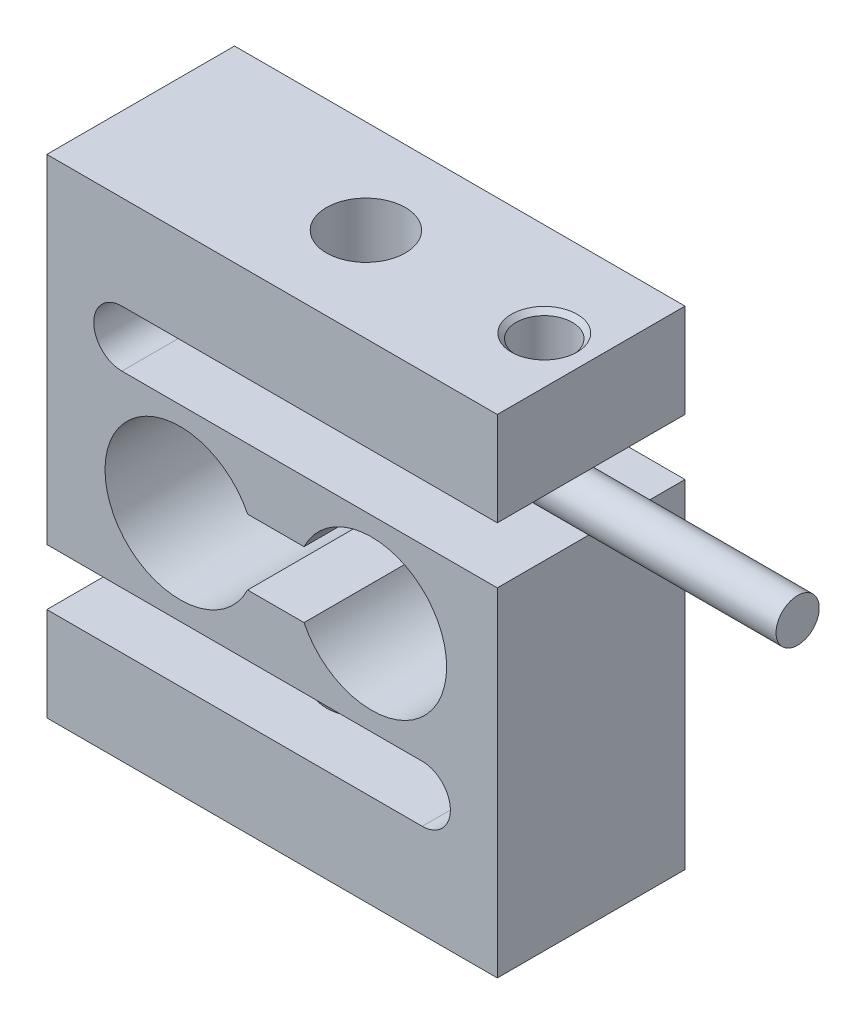
from build123d import *

# Parameters (mm, degrees)
SKIZZE1_W                            = 24
SKIZZE1_H                            = 26
AUFSATZ_LINEAR_AUSTRAGEN1_DEPTH      = 10
SCHNITT_LINEAR_AUSTRAGEN1_DEPTH      = 21.322401433
SCHNITT_LINEAR_AUSTRAGEN2_DEPTH      = 21.322401433
SCHNITT_LINEAR_AUSTRAGEN3_DEPTH      = 21.322401433
SKIZZE5_W                            = 4
SKIZZE5_H                            = 10
SKIZZE6_W                            = 4
SKIZZE6_H                            = 10
F_2_3_2_3_DURCHMESSER_BOHRUNG1_D     = 2.3
F_2_3_2_3_DURCHMESSER_BOHRUNG1_DEPTH = 24
SKIZZE9_W                            = 2.1
SKIZZE9_H                            = 5
F_3_0_3_DURCHMESSER_BOHRUNG1_D       = 3
F_3_0_3_DURCHMESSER_BOHRUNG1_DEPTH   = 5
SKIZZE13_W                           = 2.1
SKIZZE13_H                           = 5
F_3_0_3_DURCHMESSER_BOHRUNG2_D       = 3
F_3_0_3_DURCHMESSER_BOHRUNG2_DEPTH   = 5
FASE1_SIZE                           = 0.25
SENSORKABEL_START                    = -35
SKIZZE24_R                           = 1.15
SENSORKABEL_DEPTH                    = 35


with BuildPart() as part:
    # Skizze1 → Aufsatz-Linear austragen1 (new body)
    with BuildSketch(Plane.XY.offset(5)):
        Rectangle(SKIZZE1_W, SKIZZE1_H)
    extrude(amount=-AUFSATZ_LINEAR_AUSTRAGEN1_DEPTH)

    # Skizze2 → Schnitt-Linear austragen1 (cut, through all)
    with BuildSketch(Plane(origin=(0, 0, -5), x_dir=(-1, 0, 0), z_dir=(0, 0, -1))):
        with BuildLine():
            Line((12, -8), (12, -5))
            Line((12, -5), (-8, -5))
            ThreePointArc((-8, -5), (-9.5, -6.5), (-8, -8))
            Line((-8, -8), (12, -8))
        make_face()
    extrude(amount=-SCHNITT_LINEAR_AUSTRAGEN1_DEPTH, mode=Mode.SUBTRACT)

    # Skizze3 → Schnitt-Linear austragen2 (cut, through all)
    with BuildSketch(Plane(origin=(0, 0, -5), x_dir=(-1, 0, 0), z_dir=(0, 0, -1))):
        with BuildLine():
            Line((-12, 8), (-12, 5))
            Line((-12, 5), (8, 5))
            ThreePointArc((8, 5), (9.5, 6.5), (8, 8))
            Line((8, 8), (-12, 8))
        make_face()
    extrude(amount=-SCHNITT_LINEAR_AUSTRAGEN2_DEPTH, mode=Mode.SUBTRACT)

    # Skizze4 → Schnitt-Linear austragen3 (cut, through all)
    with BuildSketch(Plane(origin=(0, 0, -5), x_dir=(-1, 0, 0), z_dir=(0, 0, -1))):
        with BuildLine():
            Line((-1.703126358, -1.75), (1.303126358, -1.75))
            ThreePointArc((1.303126358, -1.75), (0.9, 0), (1.303126358, 1.75))
            Line((1.303126358, 1.75), (-1.703126358, 1.75))
            ThreePointArc((-1.703126358, 1.75), (-1.3, 0), (-1.703126358, -1.75))
        make_face()
    extrude(amount=-SCHNITT_LINEAR_AUSTRAGEN3_DEPTH, mode=Mode.SUBTRACT)

    # Skizze5 → Schnitt-Rotation1 (revolve, cut)
    with BuildSketch(Plane(origin=(0, 0, 0), x_dir=(1, 0, 0), z_dir=(0, 1, 0))):
        with Locations((7.3, 0)):
            Rectangle(SKIZZE5_W, SKIZZE5_H)
    revolve(axis=Axis((5.3, 0, -5), (0, 0, 1)), mode=Mode.SUBTRACT)

    # Skizze6 → Schnitt-Rotation2 (revolve, cut)
    with BuildSketch(Plane(origin=(0, 0, 0), x_dir=(1, 0, 0), z_dir=(0, 1, 0))):
        with Locations((-2.9, 0)):
            Rectangle(SKIZZE6_W, SKIZZE6_H)
    revolve(axis=Axis((-4.9, 0, -5), (0, 0, 1)), mode=Mode.SUBTRACT)

    # Ø2.3 (2.3) Durchmesser Bohrung1
    with Locations(Plane.ZY.offset(12)):
        with Locations((0, 6.5)):
            Hole(F_2_3_2_3_DURCHMESSER_BOHRUNG1_D / 2, depth=F_2_3_2_3_DURCHMESSER_BOHRUNG1_DEPTH)

    # Skizze9 → M5 Gewindebohrung1 (revolve, cut)
    with BuildSketch(Plane(origin=(0, 8, 0), x_dir=(0, 0, -1), z_dir=(1, 0, 0))):
        with Locations((1.05, 2.5)):
            Rectangle(SKIZZE9_W, SKIZZE9_H)
    revolve(axis=Axis((0, 1.65, 0), (0, 1, 0)), mode=Mode.SUBTRACT)

    # Ø3.0 (3) Durchmesser Bohrung1
    with Locations(Plane(origin=(0, 13, 0), x_dir=(1, 0, 0), z_dir=(0, 1, 0))):
        with Locations((9.5, 0)):
            Hole(F_3_0_3_DURCHMESSER_BOHRUNG1_D / 2, depth=F_3_0_3_DURCHMESSER_BOHRUNG1_DEPTH)

    # Skizze13 → M5 Gewindebohrung2 (revolve, cut)
    with BuildSketch(Plane(origin=(0, -8, 0), x_dir=(0, 0, 1), z_dir=(1, 0, 0))):
        with Locations((1.05, 2.5)):
            Rectangle(SKIZZE13_W, SKIZZE13_H)
    revolve(axis=Axis((0, -1.65, 0), (0, -1, 0)), mode=Mode.SUBTRACT)

    # Ø3.0 (3) Durchmesser Bohrung2
    with Locations(Plane(origin=(0, -13, 0), x_dir=(-1, 0, 0), z_dir=(0, -1, 0))):
        with Locations((9.5, 0)):
            Hole(F_3_0_3_DURCHMESSER_BOHRUNG2_D / 2, depth=F_3_0_3_DURCHMESSER_BOHRUNG2_DEPTH)

    # Fase1
    fase1_edges = [part.edges().sort_by_distance(p)[0] for p in [
        (11, 13, 0),
        (-11, -13, 0),
    ]]
    chamfer(fase1_edges, length=FASE1_SIZE)

    # Skizze24 → Sensorkabel (add)
    with BuildSketch(Plane.ZY.offset(12).offset(SENSORKABEL_START)):
        with Locations((0, 6.5)):
            Circle(SKIZZE24_R)
    extrude(amount=SENSORKABEL_DEPTH)


solid = part.part
